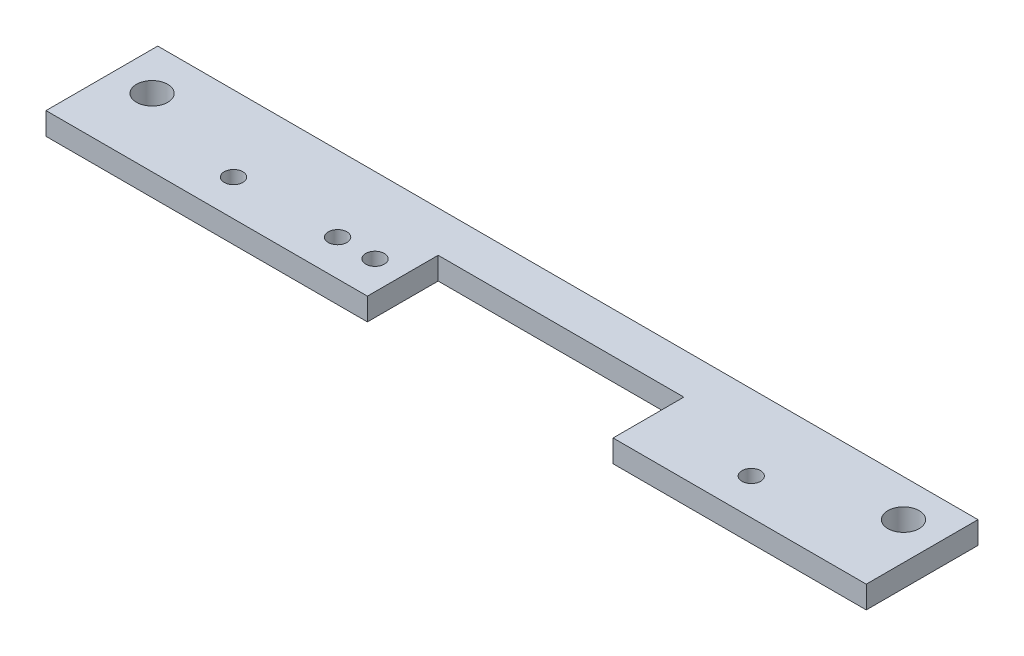
from build123d import *

# Parameters (mm, degrees)
CROQUIS1_W              = 110.11
CROQUIS1_H              = 15
CROQUIS1_R              = 2.1
CROQUIS1_R_2            = 1.25
SALIENTE_EXTRUIR1_DEPTH = 3
CROQUIS4_W              = 30.354739951
CROQUIS4_H              = 9.499551224
CORTAR_EXTRUIR2_DEPTH   = 3
CROQUIS5_W              = 2.625048137
CROQUIS5_H              = 9.499551224
CORTAR_EXTRUIR3_DEPTH   = 3


with BuildPart() as part:
    # Croquis1 → Saliente-Extruir1 (new body)
    with BuildSketch(Plane(origin=(0, 0, 0), x_dir=(1, 0, 0), z_dir=(0, 1, 0))):
        Rectangle(CROQUIS1_W, CROQUIS1_H)
        with Locations(Location((50.055, 2.5, 0), (0, 0, 270))):
            Circle(CROQUIS1_R, mode=Mode.SUBTRACT)
        with Locations(Location((-49.941192306, 1.62734645, 0), (0, 0, 270))):
            Circle(CROQUIS1_R, mode=Mode.SUBTRACT)
        with Locations(Location((-20.765904609, -2.646032213, 0), (0, 0, 270))):
            Circle(CROQUIS1_R_2, mode=Mode.SUBTRACT)
        with Locations(Location((-34.735904609, -2.646032213, 0), (0, 0, 270))):
            Circle(CROQUIS1_R_2, mode=Mode.SUBTRACT)
        with Locations(Location((-15.735904609, -2.646032213, 0), (0, 0, 270))):
            Circle(CROQUIS1_R_2, mode=Mode.SUBTRACT)
        with Locations(Location((34.764095391, -2.646032213, 0), (0, 0, 270))):
            Circle(CROQUIS1_R_2, mode=Mode.SUBTRACT)
    extrude(amount=SALIENTE_EXTRUIR1_DEPTH)

    # Croquis4 → Cortar-Extruir2 (cut)
    with BuildSketch(Plane(origin=(0, 3, 0), x_dir=(1, 0, 0), z_dir=(0, 1, 0))):
        with Locations((3.265938607, -2.750224388)):
            Rectangle(CROQUIS4_W, CROQUIS4_H)
    extrude(amount=-CORTAR_EXTRUIR2_DEPTH, mode=Mode.SUBTRACT)

    # Croquis5 → Cortar-Extruir3 (cut)
    with BuildSketch(Plane(origin=(0, 3, 0), x_dir=(1, 0, 0), z_dir=(0, 1, 0))):
        with Locations((19.755832652, -2.750224388)):
            Rectangle(CROQUIS5_W, CROQUIS5_H)
    extrude(amount=-CORTAR_EXTRUIR3_DEPTH, mode=Mode.SUBTRACT)


solid = part.part
